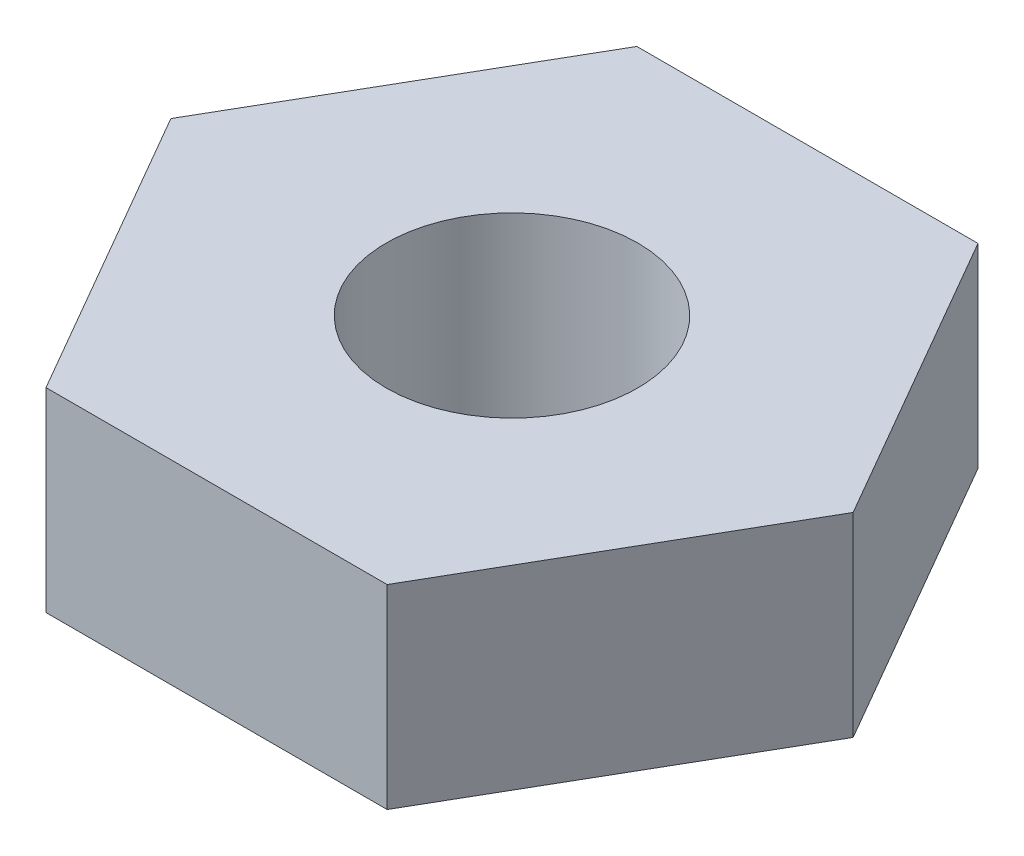
from build123d import *

# Parameters (mm, degrees)
SKETCH1_R           = 2
BOSS_EXTRUDE1_DEPTH = 3.1


with BuildPart() as part:
    # Sketch1 → Boss-Extrude1 (new body)
    with BuildSketch(Plane(origin=(0, 0, 0), x_dir=(1, 0, 0), z_dir=(0, 1, 0))):
        Polygon((-2.713546265, 4.7), (-5.42709253, 0), (-2.713546265, -4.7), (2.713546265, -4.7), (5.42709253, 0), (2.713546265, 4.7), align=None)
        with Locations(Location((0, 0, 0), (0, 0, 90))):
            Circle(SKETCH1_R, mode=Mode.SUBTRACT)
    extrude(amount=BOSS_EXTRUDE1_DEPTH)


solid = part.part
